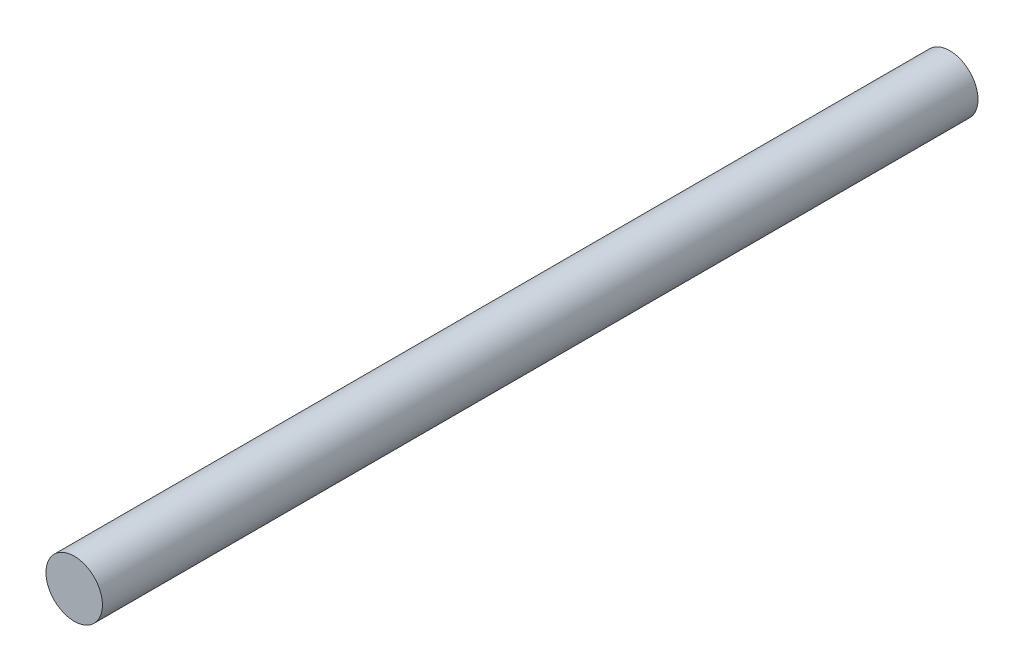
from build123d import *

# Parameters (mm, degrees)
SKETCH1_R           = 2
BOSS_EXTRUDE1_DEPTH = 62


with BuildPart() as part:
    # Sketch1 → Boss-Extrude1 (new body)
    with BuildSketch(Plane.XY):
        Circle(SKETCH1_R)
    extrude(amount=BOSS_EXTRUDE1_DEPTH)


solid = part.part
